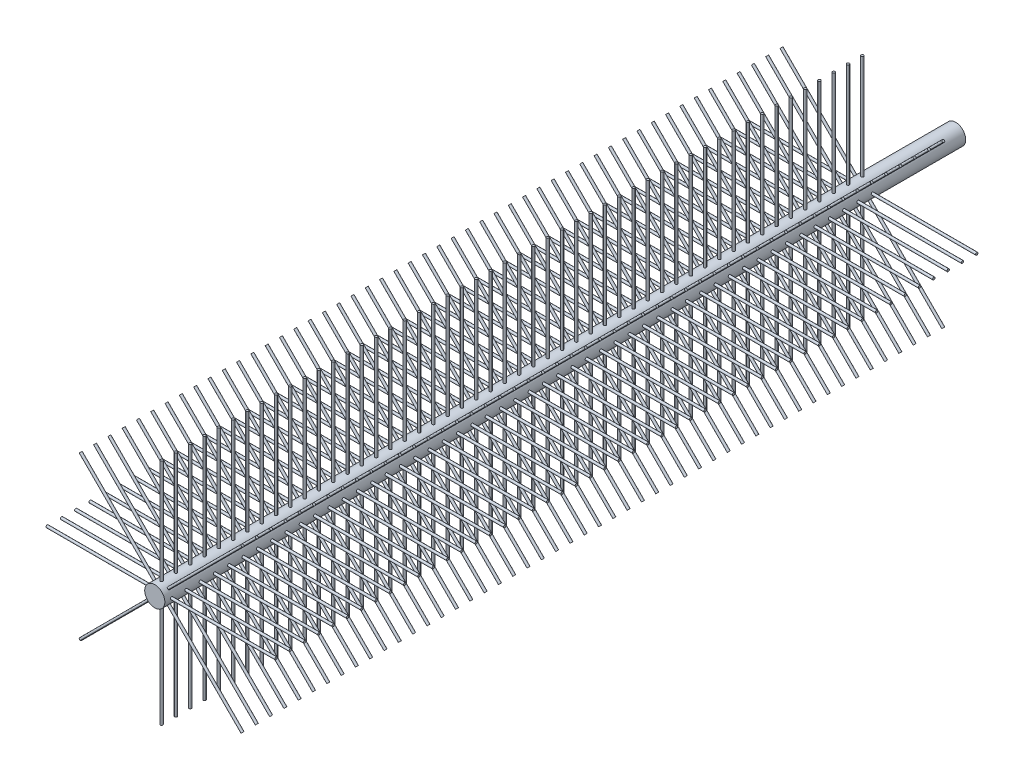
from build123d import *

# Parameters (mm, degrees)
SKETCH1_R           = 1.761349301
BOSS_EXTRUDE1_DEPTH = 140
SKETCH2_R           = 0.214564069
BOSS_EXTRUDE3_DEPTH = 20
CIRPATTERN8_COUNT   = 8
LPATTERN2_COUNT     = 50
LPATTERN2_PITCH     = 2.5


with BuildPart() as part:
    # Sketch1 → Boss-Extrude1 (new body)
    with BuildSketch(Plane.XY):
        Circle(SKETCH1_R)
    extrude(amount=-BOSS_EXTRUDE1_DEPTH)


with BuildPart() as body_2:
    # Sketch2 → Boss-Extrude3 (new body)
    with BuildSketch(Plane(origin=(0, 0, 0), x_dir=(0, 0, -1), z_dir=(1, 0, 0))):
        with Locations((1.19886759, 0)):
            Circle(SKETCH2_R)
    extrude(amount=BOSS_EXTRUDE3_DEPTH)


with BuildPart() as cirpattern8_1:
    # CirPattern8: pattern copy
    add(body_2.part.rotate(Axis((0, 0, 0), (0, 0, 1)), 1 * 360 / CIRPATTERN8_COUNT))


with BuildPart() as cirpattern8_2:
    # CirPattern8: pattern copy
    add(body_2.part.rotate(Axis((0, 0, 0), (0, 0, 1)), 2 * 360 / CIRPATTERN8_COUNT))


with BuildPart() as cirpattern8_3:
    # CirPattern8: pattern copy
    add(body_2.part.rotate(Axis((0, 0, 0), (0, 0, 1)), 3 * 360 / CIRPATTERN8_COUNT))


with BuildPart() as cirpattern8_4:
    # CirPattern8: pattern copy
    add(body_2.part.rotate(Axis((0, 0, 0), (0, 0, 1)), 4 * 360 / CIRPATTERN8_COUNT))


with BuildPart() as cirpattern8_5:
    # CirPattern8: pattern copy
    add(body_2.part.rotate(Axis((0, 0, 0), (0, 0, 1)), 5 * 360 / CIRPATTERN8_COUNT))


with BuildPart() as cirpattern8_6:
    # CirPattern8: pattern copy
    add(body_2.part.rotate(Axis((0, 0, 0), (0, 0, 1)), 6 * 360 / CIRPATTERN8_COUNT))


with BuildPart() as cirpattern8_7:
    # CirPattern8: pattern copy
    add(body_2.part.rotate(Axis((0, 0, 0), (0, 0, 1)), 7 * 360 / CIRPATTERN8_COUNT))


with BuildPart() as body_2_1:
    add(body_2.part)

    # Combine1: union CirPattern8_1, CirPattern8_2, CirPattern8_3, CirPattern8_4, CirPattern8_5, CirPattern8_6, CirPattern8_7
    add(cirpattern8_1.part)
    add(cirpattern8_2.part)
    add(cirpattern8_3.part)
    add(cirpattern8_4.part)
    add(cirpattern8_5.part)
    add(cirpattern8_6.part)
    add(cirpattern8_7.part)


with BuildPart() as lpattern2_1:
    # LPattern2: pattern copy
    add(body_2_1.part.moved(Location(Vector(0, 0, -1) * (1 * LPATTERN2_PITCH))))


with BuildPart() as lpattern2_2:
    # LPattern2: pattern copy
    add(body_2_1.part.moved(Location(Vector(0, 0, -1) * (2 * LPATTERN2_PITCH))))


with BuildPart() as lpattern2_3:
    # LPattern2: pattern copy
    add(body_2_1.part.moved(Location(Vector(0, 0, -1) * (3 * LPATTERN2_PITCH))))


with BuildPart() as lpattern2_4:
    # LPattern2: pattern copy
    add(body_2_1.part.moved(Location(Vector(0, 0, -1) * (4 * LPATTERN2_PITCH))))


with BuildPart() as lpattern2_5:
    # LPattern2: pattern copy
    add(body_2_1.part.moved(Location(Vector(0, 0, -1) * (5 * LPATTERN2_PITCH))))


with BuildPart() as lpattern2_6:
    # LPattern2: pattern copy
    add(body_2_1.part.moved(Location(Vector(0, 0, -1) * (6 * LPATTERN2_PITCH))))


with BuildPart() as lpattern2_7:
    # LPattern2: pattern copy
    add(body_2_1.part.moved(Location(Vector(0, 0, -1) * (7 * LPATTERN2_PITCH))))


with BuildPart() as lpattern2_8:
    # LPattern2: pattern copy
    add(body_2_1.part.moved(Location(Vector(0, 0, -1) * (8 * LPATTERN2_PITCH))))


with BuildPart() as lpattern2_9:
    # LPattern2: pattern copy
    add(body_2_1.part.moved(Location(Vector(0, 0, -1) * (9 * LPATTERN2_PITCH))))


with BuildPart() as lpattern2_10:
    # LPattern2: pattern copy
    add(body_2_1.part.moved(Location(Vector(0, 0, -1) * (10 * LPATTERN2_PITCH))))


with BuildPart() as lpattern2_11:
    # LPattern2: pattern copy
    add(body_2_1.part.moved(Location(Vector(0, 0, -1) * (11 * LPATTERN2_PITCH))))


with BuildPart() as lpattern2_12:
    # LPattern2: pattern copy
    add(body_2_1.part.moved(Location(Vector(0, 0, -1) * (12 * LPATTERN2_PITCH))))


with BuildPart() as lpattern2_13:
    # LPattern2: pattern copy
    add(body_2_1.part.moved(Location(Vector(0, 0, -1) * (13 * LPATTERN2_PITCH))))


with BuildPart() as lpattern2_14:
    # LPattern2: pattern copy
    add(body_2_1.part.moved(Location(Vector(0, 0, -1) * (14 * LPATTERN2_PITCH))))


with BuildPart() as lpattern2_15:
    # LPattern2: pattern copy
    add(body_2_1.part.moved(Location(Vector(0, 0, -1) * (15 * LPATTERN2_PITCH))))


with BuildPart() as lpattern2_16:
    # LPattern2: pattern copy
    add(body_2_1.part.moved(Location(Vector(0, 0, -1) * (16 * LPATTERN2_PITCH))))


with BuildPart() as lpattern2_17:
    # LPattern2: pattern copy
    add(body_2_1.part.moved(Location(Vector(0, 0, -1) * (17 * LPATTERN2_PITCH))))


with BuildPart() as lpattern2_18:
    # LPattern2: pattern copy
    add(body_2_1.part.moved(Location(Vector(0, 0, -1) * (18 * LPATTERN2_PITCH))))


with BuildPart() as lpattern2_19:
    # LPattern2: pattern copy
    add(body_2_1.part.moved(Location(Vector(0, 0, -1) * (19 * LPATTERN2_PITCH))))


with BuildPart() as lpattern2_20:
    # LPattern2: pattern copy
    add(body_2_1.part.moved(Location(Vector(0, 0, -1) * (20 * LPATTERN2_PITCH))))


with BuildPart() as lpattern2_21:
    # LPattern2: pattern copy
    add(body_2_1.part.moved(Location(Vector(0, 0, -1) * (21 * LPATTERN2_PITCH))))


with BuildPart() as lpattern2_22:
    # LPattern2: pattern copy
    add(body_2_1.part.moved(Location(Vector(0, 0, -1) * (22 * LPATTERN2_PITCH))))


with BuildPart() as lpattern2_23:
    # LPattern2: pattern copy
    add(body_2_1.part.moved(Location(Vector(0, 0, -1) * (23 * LPATTERN2_PITCH))))


with BuildPart() as lpattern2_24:
    # LPattern2: pattern copy
    add(body_2_1.part.moved(Location(Vector(0, 0, -1) * (24 * LPATTERN2_PITCH))))


with BuildPart() as lpattern2_25:
    # LPattern2: pattern copy
    add(body_2_1.part.moved(Location(Vector(0, 0, -1) * (25 * LPATTERN2_PITCH))))


with BuildPart() as lpattern2_26:
    # LPattern2: pattern copy
    add(body_2_1.part.moved(Location(Vector(0, 0, -1) * (26 * LPATTERN2_PITCH))))


with BuildPart() as lpattern2_27:
    # LPattern2: pattern copy
    add(body_2_1.part.moved(Location(Vector(0, 0, -1) * (27 * LPATTERN2_PITCH))))


with BuildPart() as lpattern2_28:
    # LPattern2: pattern copy
    add(body_2_1.part.moved(Location(Vector(0, 0, -1) * (28 * LPATTERN2_PITCH))))


with BuildPart() as lpattern2_29:
    # LPattern2: pattern copy
    add(body_2_1.part.moved(Location(Vector(0, 0, -1) * (29 * LPATTERN2_PITCH))))


with BuildPart() as lpattern2_30:
    # LPattern2: pattern copy
    add(body_2_1.part.moved(Location(Vector(0, 0, -1) * (30 * LPATTERN2_PITCH))))


with BuildPart() as lpattern2_31:
    # LPattern2: pattern copy
    add(body_2_1.part.moved(Location(Vector(0, 0, -1) * (31 * LPATTERN2_PITCH))))


with BuildPart() as lpattern2_32:
    # LPattern2: pattern copy
    add(body_2_1.part.moved(Location(Vector(0, 0, -1) * (32 * LPATTERN2_PITCH))))


with BuildPart() as lpattern2_33:
    # LPattern2: pattern copy
    add(body_2_1.part.moved(Location(Vector(0, 0, -1) * (33 * LPATTERN2_PITCH))))


with BuildPart() as lpattern2_34:
    # LPattern2: pattern copy
    add(body_2_1.part.moved(Location(Vector(0, 0, -1) * (34 * LPATTERN2_PITCH))))


with BuildPart() as lpattern2_35:
    # LPattern2: pattern copy
    add(body_2_1.part.moved(Location(Vector(0, 0, -1) * (35 * LPATTERN2_PITCH))))


with BuildPart() as lpattern2_36:
    # LPattern2: pattern copy
    add(body_2_1.part.moved(Location(Vector(0, 0, -1) * (36 * LPATTERN2_PITCH))))


with BuildPart() as lpattern2_37:
    # LPattern2: pattern copy
    add(body_2_1.part.moved(Location(Vector(0, 0, -1) * (37 * LPATTERN2_PITCH))))


with BuildPart() as lpattern2_38:
    # LPattern2: pattern copy
    add(body_2_1.part.moved(Location(Vector(0, 0, -1) * (38 * LPATTERN2_PITCH))))


with BuildPart() as lpattern2_39:
    # LPattern2: pattern copy
    add(body_2_1.part.moved(Location(Vector(0, 0, -1) * (39 * LPATTERN2_PITCH))))


with BuildPart() as lpattern2_40:
    # LPattern2: pattern copy
    add(body_2_1.part.moved(Location(Vector(0, 0, -1) * (40 * LPATTERN2_PITCH))))


with BuildPart() as lpattern2_41:
    # LPattern2: pattern copy
    add(body_2_1.part.moved(Location(Vector(0, 0, -1) * (41 * LPATTERN2_PITCH))))


with BuildPart() as lpattern2_42:
    # LPattern2: pattern copy
    add(body_2_1.part.moved(Location(Vector(0, 0, -1) * (42 * LPATTERN2_PITCH))))


with BuildPart() as lpattern2_43:
    # LPattern2: pattern copy
    add(body_2_1.part.moved(Location(Vector(0, 0, -1) * (43 * LPATTERN2_PITCH))))


with BuildPart() as lpattern2_44:
    # LPattern2: pattern copy
    add(body_2_1.part.moved(Location(Vector(0, 0, -1) * (44 * LPATTERN2_PITCH))))


with BuildPart() as lpattern2_45:
    # LPattern2: pattern copy
    add(body_2_1.part.moved(Location(Vector(0, 0, -1) * (45 * LPATTERN2_PITCH))))


with BuildPart() as lpattern2_46:
    # LPattern2: pattern copy
    add(body_2_1.part.moved(Location(Vector(0, 0, -1) * (46 * LPATTERN2_PITCH))))


with BuildPart() as lpattern2_47:
    # LPattern2: pattern copy
    add(body_2_1.part.moved(Location(Vector(0, 0, -1) * (47 * LPATTERN2_PITCH))))


with BuildPart() as lpattern2_48:
    # LPattern2: pattern copy
    add(body_2_1.part.moved(Location(Vector(0, 0, -1) * (48 * LPATTERN2_PITCH))))


with BuildPart() as lpattern2_49:
    # LPattern2: pattern copy
    add(body_2_1.part.moved(Location(Vector(0, 0, -1) * (49 * LPATTERN2_PITCH))))


solid = Compound([part.part, body_2_1.part, lpattern2_1.part, lpattern2_2.part, lpattern2_3.part, lpattern2_4.part, lpattern2_5.part, lpattern2_6.part, lpattern2_7.part, lpattern2_8.part, lpattern2_9.part, lpattern2_10.part, lpattern2_11.part, lpattern2_12.part, lpattern2_13.part, lpattern2_14.part, lpattern2_15.part, lpattern2_16.part, lpattern2_17.part, lpattern2_18.part, lpattern2_19.part, lpattern2_20.part, lpattern2_21.part, lpattern2_22.part, lpattern2_23.part, lpattern2_24.part, lpattern2_25.part, lpattern2_26.part, lpattern2_27.part, lpattern2_28.part, lpattern2_29.part, lpattern2_30.part, lpattern2_31.part, lpattern2_32.part, lpattern2_33.part, lpattern2_34.part, lpattern2_35.part, lpattern2_36.part, lpattern2_37.part, lpattern2_38.part, lpattern2_39.part, lpattern2_40.part, lpattern2_41.part, lpattern2_42.part, lpattern2_43.part, lpattern2_44.part, lpattern2_45.part, lpattern2_46.part, lpattern2_47.part, lpattern2_48.part, lpattern2_49.part])
